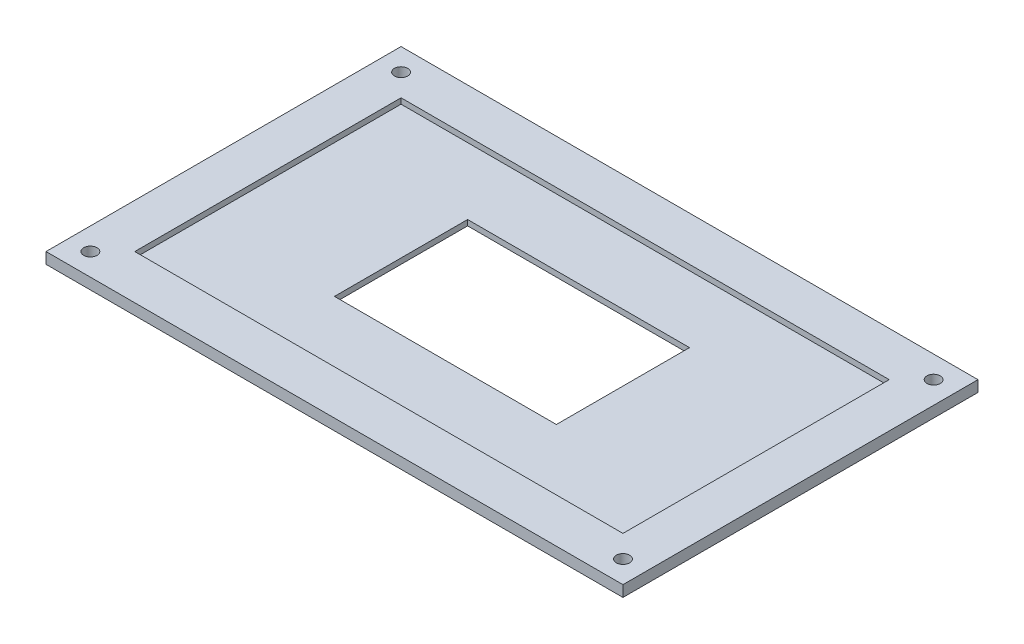
from build123d import *

# Parameters (mm, degrees)
SKETCH1_W           = 130
SKETCH1_H           = 80
BOSS_EXTRUDE1_DEPTH = 2.5
SKETCH2_W           = 110
SKETCH2_H           = 60
CUT_EXTRUDE1_DEPTH  = 1.25
SKETCH3_R           = 1.5
CUT_EXTRUDE2_DEPTH  = 153.663846408
SKETCH4_W           = 50
SKETCH4_H           = 30
CUT_EXTRUDE3_DEPTH  = 153.648493278


with BuildPart() as part:
    # Sketch1 → Boss-Extrude1 (new body)
    with BuildSketch(Plane(origin=(0, 0, 0), x_dir=(1, 0, 0), z_dir=(0, 1, 0))):
        with Locations((65, 40)):
            Rectangle(SKETCH1_W, SKETCH1_H)
    extrude(amount=BOSS_EXTRUDE1_DEPTH)

    # Sketch2 → Cut-Extrude1 (cut)
    with BuildSketch(Plane(origin=(0, 2.5, 0), x_dir=(1, 0, 0), z_dir=(0, 1, 0))):
        with Locations((65, 40)):
            Rectangle(SKETCH2_W, SKETCH2_H)
    extrude(amount=-CUT_EXTRUDE1_DEPTH, mode=Mode.SUBTRACT)

    # Sketch3 → Cut-Extrude2 (cut, through all)
    with BuildSketch(Plane(origin=(0, 2.5, 0), x_dir=(1, 0, 0), z_dir=(0, 1, 0))):
        with Locations(Location((5, 75, 0), (0, 0, 270))):
            Circle(SKETCH3_R)
        with Locations(Location((125, 75, 0), (0, 0, 270))):
            Circle(SKETCH3_R)
        with Locations(Location((125, 5, 0), (0, 0, 270))):
            Circle(SKETCH3_R)
        with Locations(Location((5, 5, 0), (0, 0, 270))):
            Circle(SKETCH3_R)
    extrude(amount=-CUT_EXTRUDE2_DEPTH, mode=Mode.SUBTRACT)

    # Sketch4 → Cut-Extrude3 (cut, through all)
    with BuildSketch(Plane(origin=(0, 1.25, 0), x_dir=(1, 0, 0), z_dir=(0, 1, 0))):
        with Locations((65, 40)):
            Rectangle(SKETCH4_W, SKETCH4_H)
    extrude(amount=-CUT_EXTRUDE3_DEPTH, mode=Mode.SUBTRACT)


solid = part.part
